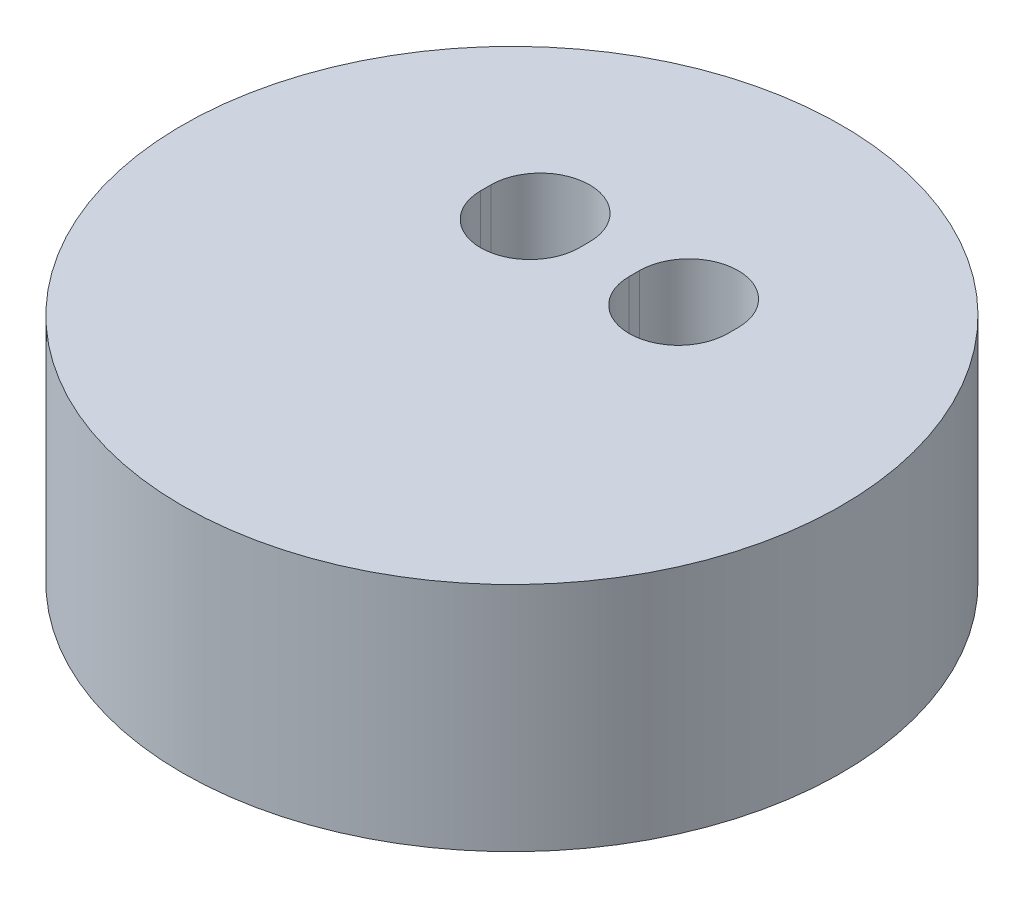
from build123d import *

# Parameters (mm, degrees)
SKETCH1_R           = 12.36
BOSS_EXTRUDE1_DEPTH = 8.678
CUT_EXTRUDE1_DEPTH  = 20.515298717


with BuildPart() as part:
    # Sketch1 → Boss-Extrude1 (new body)
    with BuildSketch(Plane(origin=(0, 0, 0), x_dir=(1, 0, 0), z_dir=(0, 1, 0))):
        with Locations(Location((0, 0, 0), (0, 0, 270))):
            Circle(SKETCH1_R)
    extrude(amount=BOSS_EXTRUDE1_DEPTH)

    # Sketch2 → Cut-Extrude1 (cut, through all)
    with BuildSketch(Plane(origin=(0, 8.678, 0), x_dir=(1, 0, 0), z_dir=(0, 1, 0))):
        with BuildLine():
            Line((4.635, 3.85), (4.635, 3.46))
            ThreePointArc((4.635, 3.46), (2.785, 1.61), (0.935, 3.46))
            Line((0.935, 3.46), (0.935, 3.85))
            ThreePointArc((0.935, 3.85), (2.785, 5.7), (4.635, 3.85))
        make_face()
        with BuildLine():
            Line((-0.935, 3.85), (-0.935, 3.46))
            ThreePointArc((-0.935, 3.46), (-2.785, 1.61), (-4.635, 3.46))
            Line((-4.635, 3.46), (-4.635, 3.85))
            ThreePointArc((-4.635, 3.85), (-2.785, 5.7), (-0.935, 3.85))
        make_face()
    extrude(amount=-CUT_EXTRUDE1_DEPTH, mode=Mode.SUBTRACT)


solid = part.part
